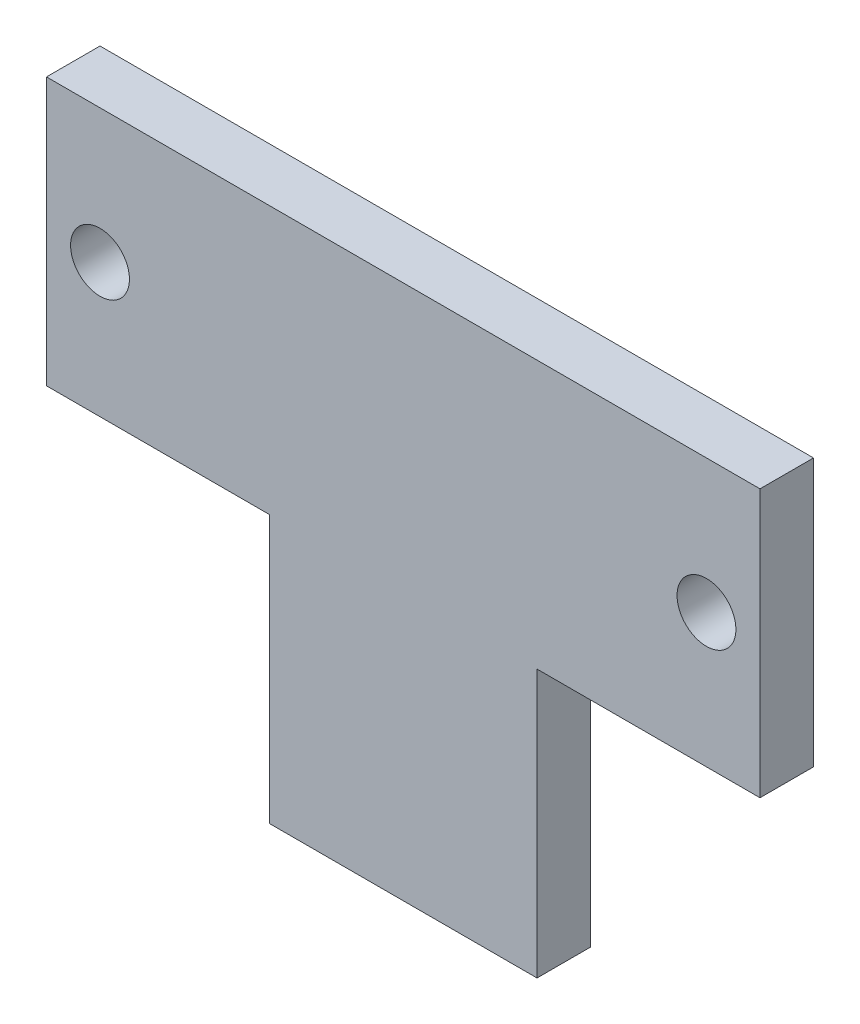
from build123d import *

# Parameters (mm, degrees)
ESQUISSE1_R        = 1.65
BOSS_EXTRU_1_DEPTH = 3


with BuildPart() as part:
    # Esquisse1 → Boss.-Extru.1 (new body)
    with BuildSketch(Plane.XY):
        Polygon((-7.5, -7.5), (-7.5, -22.5), (7.5, -22.5), (7.5, -7.5), (20, -7.5), (20, 7.5), (-20, 7.5), (-20, -7.5), align=None)
        with Locations((-17, 0)):
            Circle(ESQUISSE1_R, mode=Mode.SUBTRACT)
        with Locations((17, 0)):
            Circle(ESQUISSE1_R, mode=Mode.SUBTRACT)
    extrude(amount=-BOSS_EXTRU_1_DEPTH)


solid = part.part
